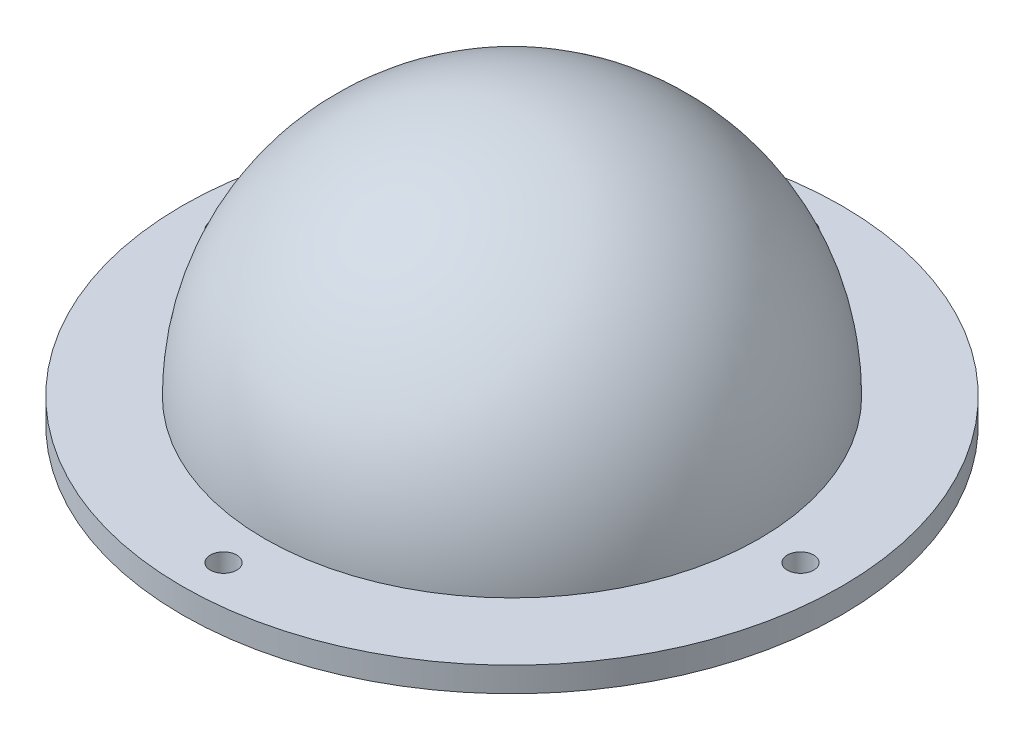
from build123d import *

# Parameters (mm, degrees)
SKETCH_2_R          = 40
SKETCH_2_R_2        = 28.5
SKETCH_2_R_3        = 1.6
EXTRUDE_1_DEPTH     = 3
SKETCH_3_R          = 29
CUT_EXTRUDE_1_DEPTH = 3


with BuildPart() as part:
    # 草图1 → 旋转1 (revolve)
    with BuildSketch(Plane.XY):
        with BuildLine():
            Line((-30, 0), (-29, 0))
            ThreePointArc((-29, 0), (-20.506096654, 20.506096654), (0, 29))
            Line((0, 29), (0, 30))
            ThreePointArc((0, 30), (-21.213203436, 21.213203436), (-30, 0))
        make_face()
    revolve(axis=Axis((0, 29, 0), (0, -1, 0)))


with BuildPart() as body_2:
    # 草图2 → 凸台-拉伸1 (new body)
    with BuildSketch(Plane.XZ):
        Circle(SKETCH_2_R)
        Circle(SKETCH_2_R_2, mode=Mode.SUBTRACT)
        with Locations((0, 35)):
            Circle(SKETCH_2_R_3, mode=Mode.SUBTRACT)
        with Locations((35, 0)):
            Circle(SKETCH_2_R_3, mode=Mode.SUBTRACT)
        with Locations((0, -35)):
            Circle(SKETCH_2_R_3, mode=Mode.SUBTRACT)
        with Locations((-35, 0)):
            Circle(SKETCH_2_R_3, mode=Mode.SUBTRACT)
    extrude(amount=EXTRUDE_1_DEPTH)

    # 草图3 → 切除-拉伸1 (cut)
    with BuildSketch(Plane.XZ.offset(3)):
        Circle(SKETCH_3_R)
    extrude(amount=-CUT_EXTRUDE_1_DEPTH, mode=Mode.SUBTRACT)


solid = Compound([part.part, body_2.part])
